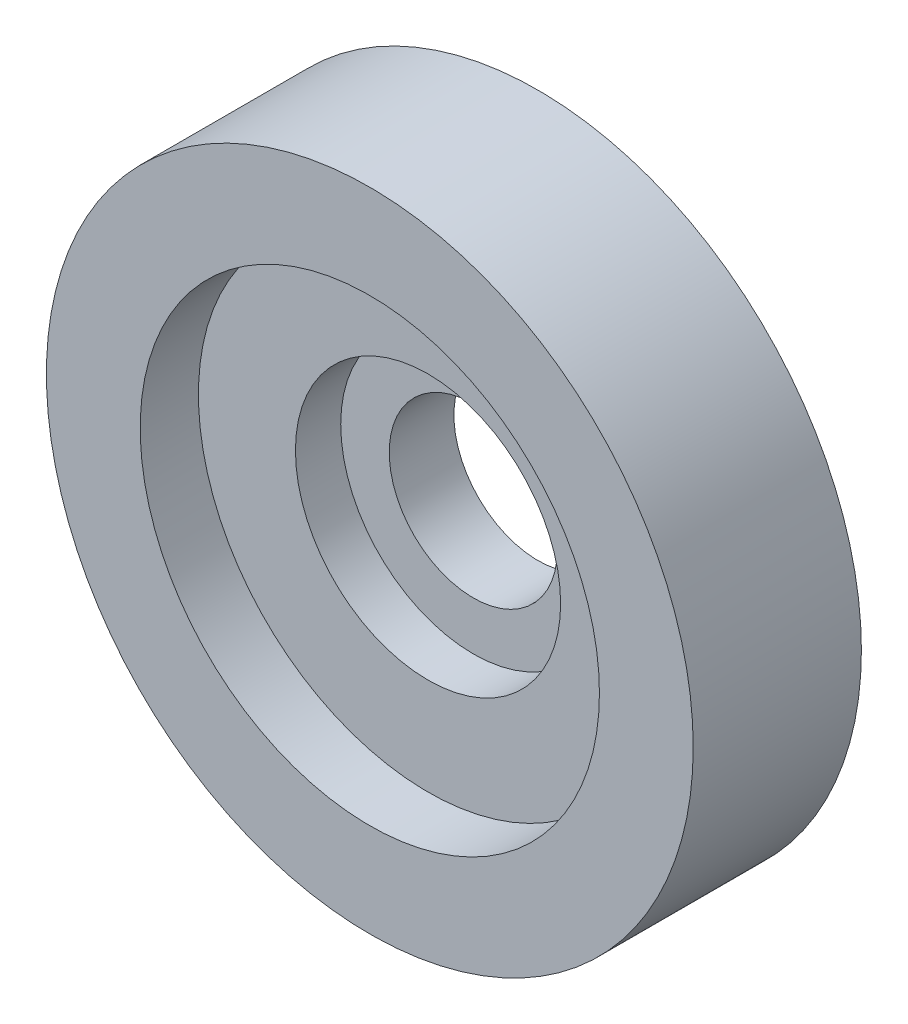
from build123d import *

# Parameters (mm, degrees)
CROQUIS1_R              = 25
SALIENTE_EXTRUIR1_DEPTH = 13
CROQUIS2_R              = 17.75
CORTAR_EXTRUIR1_DEPTH   = 4.5
CROQUIS3_R              = 10.25
CORTAR_EXTRUIR2_DEPTH   = 3.5
CORTAR_EXTRUIR3_REACH   = 38.249
CROQUIS4_R              = 6.5


with BuildPart() as part:
    # Croquis1 → Saliente-Extruir1 (new body)
    with BuildSketch(Plane.XY):
        Circle(CROQUIS1_R)
    extrude(amount=-SALIENTE_EXTRUIR1_DEPTH)

    # Croquis2 → Cortar-Extruir1 (cut)
    with BuildSketch(Plane.XY):
        Circle(CROQUIS2_R)
    extrude(amount=-CORTAR_EXTRUIR1_DEPTH, mode=Mode.SUBTRACT)

    # Croquis3 → Cortar-Extruir2 (cut)
    with BuildSketch(Plane.XY.offset(-4.5)):
        Circle(CROQUIS3_R)
    extrude(amount=-CORTAR_EXTRUIR2_DEPTH, mode=Mode.SUBTRACT)

    # Croquis4 → Cortar-Extruir3 (cut, up to next)
    with BuildSketch(Plane.XY.offset(-8), mode=Mode.PRIVATE) as cortar_extruir3_sk1:
        Circle(CROQUIS4_R)
    cortar_extruir3_tool1 = extrude(cortar_extruir3_sk1.sketch, amount=-CORTAR_EXTRUIR3_REACH, mode=Mode.PRIVATE) & part.part
    add(cortar_extruir3_tool1.solids().sort_by_distance((0, 0, -8))[0], mode=Mode.SUBTRACT)


solid = part.part
